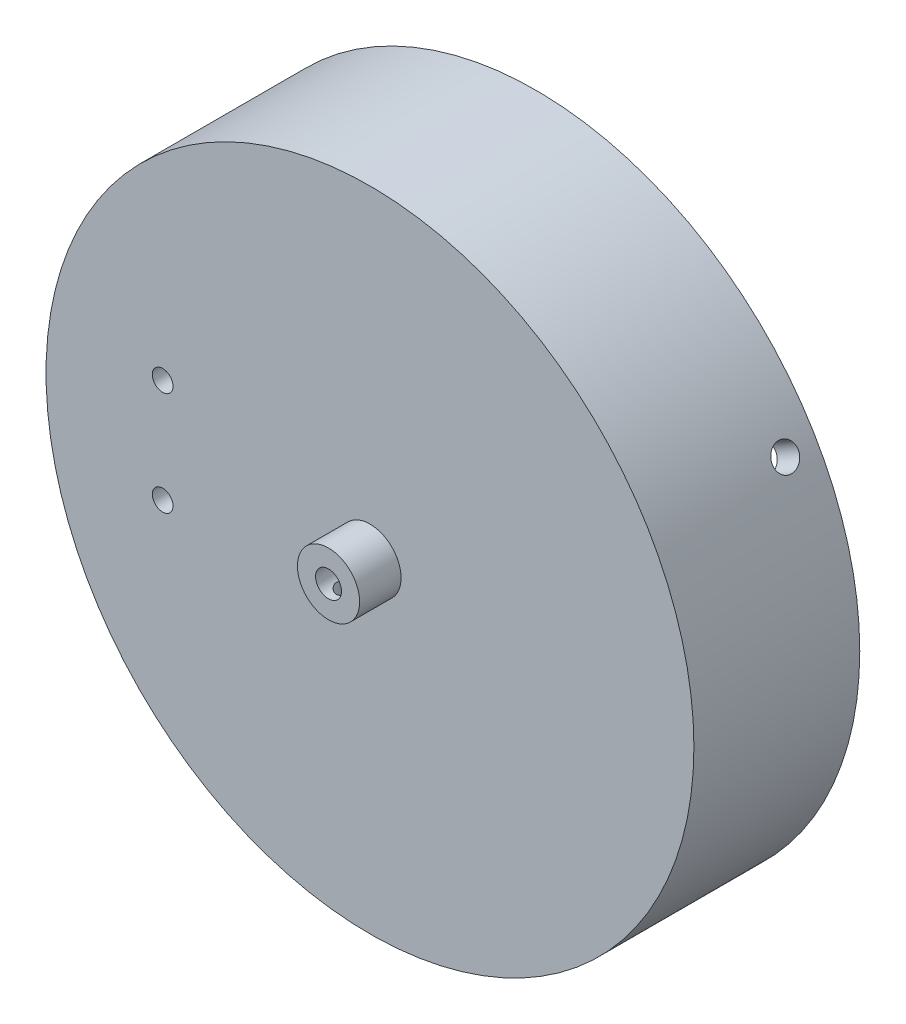
from build123d import *

# Parameters (mm, degrees)
SKETCH1_R           = 62.5
SKETCH1_R_2         = 57.5
BOSS_EXTRUDE1_DEPTH = 10
SKETCH2_R           = 62.5
BOSS_EXTRUDE2_DEPTH = 22
SKETCH3_R           = 2.5
CUT_EXTRUDE1_DEPTH  = 92.08512502
CUT_EXTRUDE2_DEPTH  = 18
SKETCH5_R           = 6
SKETCH5_R_2         = 2.5
BOSS_EXTRUDE3_DEPTH = 8
SKETCH6_R           = 1.5
CUT_EXTRUDE3_DEPTH  = 98.01803956
SKETCH7_R           = 2.5
CUT_EXTRUDE4_DEPTH  = 98.018039601
CIRPATTERN1_COUNT   = 3
SKETCH8_R           = 2
CUT_EXTRUDE5_DEPTH  = 93.717312465


with BuildPart() as part:
    # Sketch1 → Boss-Extrude1 (new body)
    with BuildSketch(Plane.XY):
        Circle(SKETCH1_R)
        Circle(SKETCH1_R_2, mode=Mode.SUBTRACT)
    extrude(amount=BOSS_EXTRUDE1_DEPTH)

    # Sketch2 → Boss-Extrude2 (add)
    with BuildSketch(Plane.XY.offset(10)):
        Circle(SKETCH2_R)
    extrude(amount=BOSS_EXTRUDE2_DEPTH)

    # Sketch3 → Cut-Extrude1 (cut, through all)
    with BuildSketch(Plane(origin=(0, 0, 10), x_dir=(-1, 0, 0), z_dir=(0, 0, -1))):
        Circle(SKETCH3_R)
    extrude(amount=-CUT_EXTRUDE1_DEPTH, mode=Mode.SUBTRACT)

    # Sketch4 → Cut-Extrude2 (cut)
    with BuildSketch(Plane(origin=(0, 0, 10), x_dir=(-1, 0, 0), z_dir=(0, 0, -1))):
        with BuildLine():
            Line((0, 16), (74.659744803, 16))
            Line((74.659744803, 16), (74.659744803, -16))
            Line((74.659744803, -16), (0, -16))
            ThreePointArc((0, -16), (-16, 0), (0, 16))
        make_face()
    extrude(amount=-CUT_EXTRUDE2_DEPTH, mode=Mode.SUBTRACT)

    # Sketch5 → Boss-Extrude3 (add)
    with BuildSketch(Plane.XY.offset(32)):
        Circle(SKETCH5_R)
        with Locations(Location((0, 0, 0), (0, 0, 180))):
            Circle(SKETCH5_R_2, mode=Mode.SUBTRACT)
    extrude(amount=BOSS_EXTRUDE3_DEPTH)

    # Sketch6 → Cut-Extrude3 (cut, through all)
    with BuildSketch(Plane(origin=(0, 0, 0), x_dir=(1, 0, 0), z_dir=(0, 1, 0))):
        with Locations(Location((0, -37, 0), (0, 0, 270))):
            Circle(SKETCH6_R)
    extrude(amount=-CUT_EXTRUDE3_DEPTH, mode=Mode.SUBTRACT)

    # Sketch7 → Cut-Extrude4 (cut, through all)
    with BuildSketch(Plane(origin=(0, 0, 0), x_dir=(1, 0, 0), z_dir=(0, 1, 0))):
        with Locations(Location((0, -6, 0), (0, 0, 270))):
            Circle(SKETCH7_R)
    cut_extrude4 = extrude(amount=-CUT_EXTRUDE4_DEPTH, mode=Mode.SUBTRACT)

    # CirPattern1: Cut-Extrude4 ×3 about axis
    cirpattern1_axis = Axis((0, 0, 0), (0, 0, 1))
    for i in range(1, CIRPATTERN1_COUNT):
        add(cut_extrude4.rotate(cirpattern1_axis, i * 360 / CIRPATTERN1_COUNT), mode=Mode.SUBTRACT)

    # Sketch8 → Cut-Extrude5 (cut, through all)
    with BuildSketch(Plane(origin=(0, 0, 28), x_dir=(-1, 0, 0), z_dir=(0, 0, -1))):
        with Locations(Location((40, 10, 0), (0, 0, 90))):
            Circle(SKETCH8_R)
        with Locations(Location((40, -10, 0), (0, 0, 90))):
            Circle(SKETCH8_R)
    extrude(amount=-CUT_EXTRUDE5_DEPTH, mode=Mode.SUBTRACT)


solid = part.part
